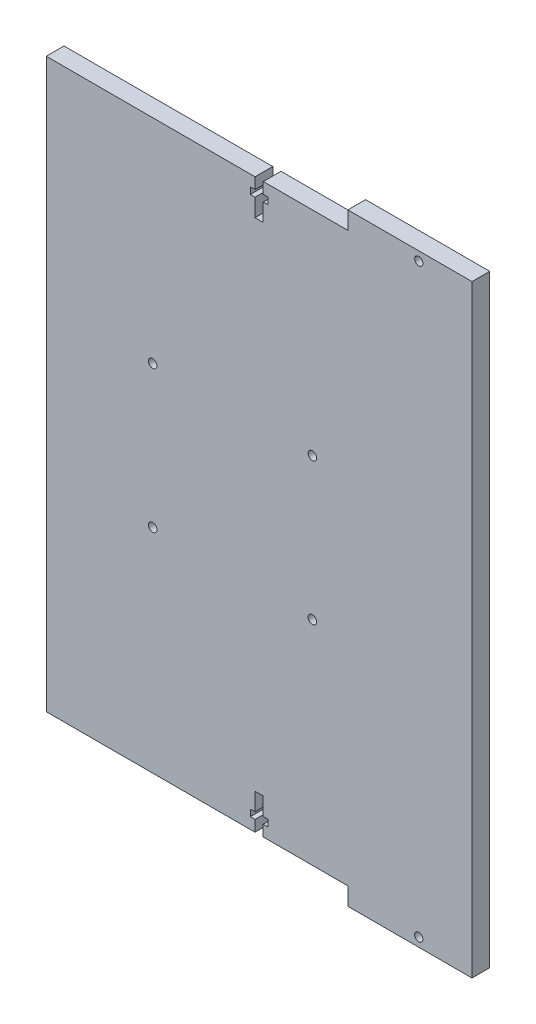
from build123d import *

# Parameters (mm, degrees)
BOSS_EXTRUDE1_DEPTH = 6.35
SKETCH2_R           = 1.4732
CUT_EXTRUDE1_DEPTH  = 265.346160366
SKETCH4_R           = 1.524
CUT_EXTRUDE2_DEPTH  = 265.346160366
SKETCH5_R           = 1.524
CUT_EXTRUDE3_DEPTH  = 265.346160366
CUT_EXTRUDE10_DEPTH = 265.346160366


with BuildPart() as part:
    # Sketch1 → Boss-Extrude1 (new body)
    with BuildSketch(Plane.XY):
        Polygon((107.95, 215.9), (107.95, 209.55), (0, 209.55), (0, 6.35), (107.95, 6.35), (107.95, 0), (152.4, 0), (152.4, 215.9), align=None)
    extrude(amount=BOSS_EXTRUDE1_DEPTH)

    # Sketch2 → Cut-Extrude1 (cut, through all)
    with BuildSketch(Plane.XY.offset(6.35)):
        with Locations(Location((133.35, 212.725, 0), (0, 0, 180))):
            Circle(SKETCH2_R)
        with Locations((133.35, 3.175)):
            Circle(SKETCH2_R)
    extrude(amount=-CUT_EXTRUDE1_DEPTH, mode=Mode.SUBTRACT)

    # Sketch4 → Cut-Extrude2 (cut, through all)
    with BuildSketch(Plane.XY.offset(6.35)):
        with Locations(Location((95.25, 133.35, 0), (0, 0, 180))):
            Circle(SKETCH4_R)
        with Locations((95.25, 82.55)):
            Circle(SKETCH4_R)
    extrude(amount=-CUT_EXTRUDE2_DEPTH, mode=Mode.SUBTRACT)

    # Sketch5 → Cut-Extrude3 (cut, through all)
    with BuildSketch(Plane.XY.offset(6.35)):
        with Locations((38.1, 133.35)):
            Circle(SKETCH5_R)
        with Locations(Location((38.1, 82.55, 0), (0, 0, 180))):
            Circle(SKETCH5_R)
    extrude(amount=-CUT_EXTRUDE3_DEPTH, mode=Mode.SUBTRACT)

    # Sketch10 → Cut-Extrude10 (cut, through all)
    with BuildSketch(Plane(origin=(0, 0, 0), x_dir=(-1, 0, 0), z_dir=(0, 0, -1))):
        Polygon((-77.6732, 6.35), (-74.7268, 6.35), (-74.7268, 10.31875), (-73.025, 10.31875), (-73.025, 12.7), (-74.7268, 12.7), (-74.7268, 19.05), (-77.6732, 19.05), (-77.6732, 12.7), (-79.375, 12.7), (-79.375, 10.31875), (-77.6732, 10.31875), align=None)
        Polygon((-73.025, 205.58125), (-73.025, 203.2), (-74.7268, 203.2), (-74.7268, 196.85), (-77.6732, 196.85), (-77.6732, 203.2), (-79.375, 203.2), (-79.375, 205.58125), (-77.6732, 205.58125), (-77.6732, 209.55), (-74.7268, 209.55), (-74.7268, 205.58125), align=None)
    extrude(amount=-CUT_EXTRUDE10_DEPTH, mode=Mode.SUBTRACT)


solid = part.part
